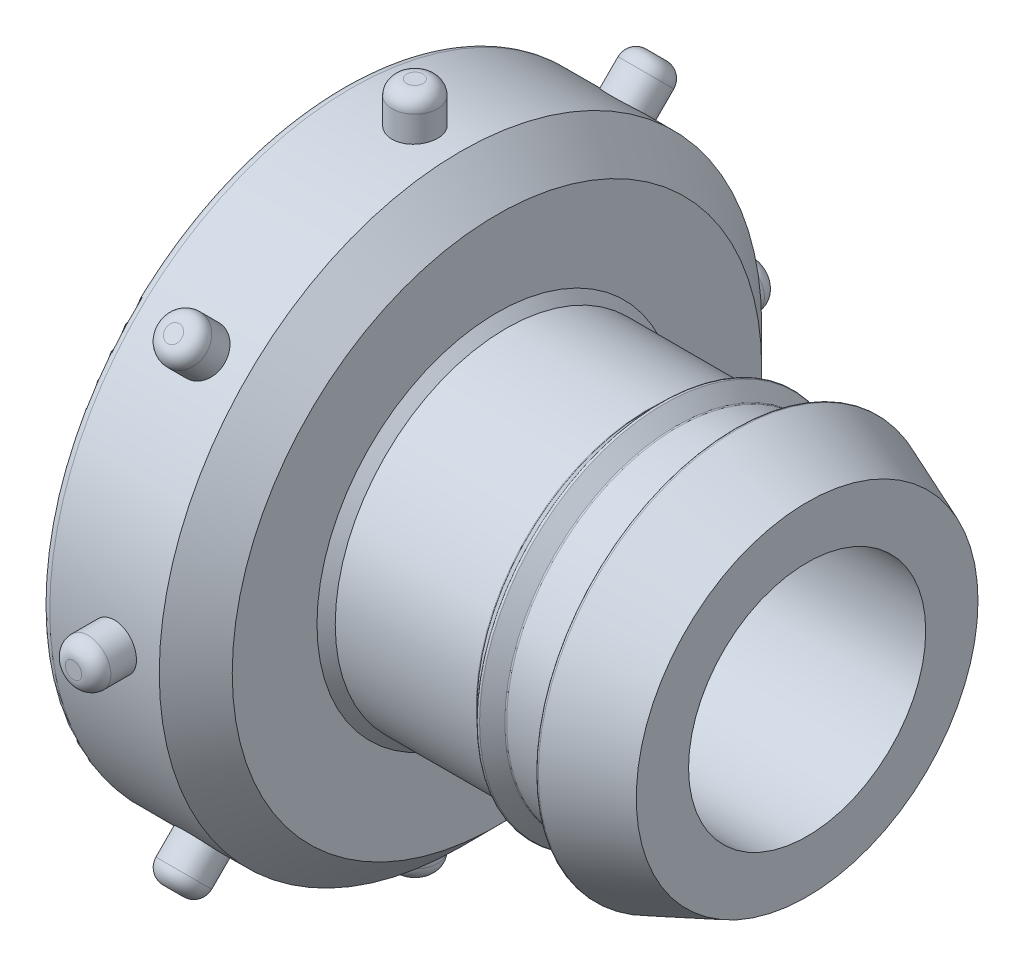
from build123d import *

# Parameters (mm, degrees)
SKETCH2_R                = 16.51
SKETCH2_R_2              = 9.365
SKETCH2_R_3              = 6.5
BOSS_EXTRUDE1_DEPTH      = 8.5
SKETCH4_W                = 18.18
SKETCH4_H                = 13.55
CUT_EXTRUDE1_DEPTH       = 7
SKETCH6_R                = 0.9
FILLET1_R                = 1
BOSS_EXTRUDE2_START      = -2
SKETCH7_R                = 1.25
BOSS_EXTRUDE2_DEPTH      = 4.2
FILLET2_R                = 0.8
CIRPATTERN1_COUNT        = 8
FILLET2_OF_CIRPATTERN1_R = 0.8
CHAMFER1_SIZE            = 2
FILLET3_R                = 0.5
FILLET4_R                = 0.1
CHAMFER2_SIZE            = 0.5
CUT_EXTRUDE2_DEPTH       = 32.450408582
CUT_EXTRUDE2_DEPTH_BACK  = 32.450408582
SKETCH2_3_R              = 6.5
CHAMFER3_SIZE            = 1
CHAMFER3_SIZE2           = 4.010780934
SKETCH8_W                = 2.59
SKETCH8_H                = 7.65
BOSS_EXTRUDE3_DEPTH      = 0.64
FILLET5_R                = 0.5


with BuildPart() as part:
    # Sketch1 → Revolve1 (revolve)
    with BuildSketch(Plane(origin=(0, 0, 0), x_dir=(1, 0, 0), z_dir=(0, 1, 0))):
        Polygon((0, 0), (-17, 0), (-17, 9.365), (-8.73, 9.365), (-7.94, 10.155), (-7.15, 9.365), (-3.97, 9.365), (-3.97, 10.955), (0, 9.365), align=None)
    revolve(axis=Axis((0, 0, 0), (-1, 0, 0)))

    # Sketch2 → Boss-Extrude1 (add)
    # profile 1 of 2: a face of its own
    with BuildSketch(Plane.ZY.offset(17)):
        Circle(SKETCH2_R)
        with Locations(Location((0, 0, 0), (0, 0, 180))):
            Circle(SKETCH2_R_2, mode=Mode.SUBTRACT)
    # profile 2 of 2: a face of its own
    with BuildSketch(Plane.ZY.offset(17)):
        with Locations(Location((0, 0, 0), (0, 0, 180))):
            Circle(SKETCH2_R_2)
        Circle(SKETCH2_R_3, mode=Mode.SUBTRACT)
    extrude(amount=BOSS_EXTRUDE1_DEPTH)

    # Sketch4 → Cut-Extrude1 (cut)
    with BuildSketch(Plane.ZY.offset(25.5)):
        with Locations((0, -0.145)):
            Rectangle(SKETCH4_W, SKETCH4_H)
    extrude(amount=-CUT_EXTRUDE1_DEPTH, mode=Mode.SUBTRACT)

    # Sketch6 → Cut-Revolve1 (revolve, cut)
    with BuildSketch(Plane.XY, mode=Mode.PRIVATE) as cut_revolve1_sk:
        with Locations((-25.5, 14.14)):
            Circle(SKETCH6_R)
    revolve(cut_revolve1_sk.sketch.rotate(Axis((-35.027065124, 0, 0), (1, 0, 0)), 90), axis=Axis((-35.027065124, 0, 0), (1, 0, 0)), mode=Mode.SUBTRACT)

    # Fillet1
    fillet1_edges = [part.edges().sort_by_distance(p)[0] for p in [
        (-25.5, 0, -13.24),
    ]]
    fillet(fillet1_edges, radius=FILLET1_R)

    # Sketch7 → Boss-Extrude2 (add)
    with BuildSketch(Plane(origin=(0, 16.51, 0), x_dir=(1, 0, 0), z_dir=(0, 1, 0)).offset(BOSS_EXTRUDE2_START)):
        with Locations(Location((-21.5, 0, 0), (0, 0, 270))):
            Circle(SKETCH7_R)
    boss_extrude2 = extrude(amount=BOSS_EXTRUDE2_DEPTH)

    # Fillet2
    fillet2_edges = [part.edges().sort_by_distance(p)[0] for p in [
        (-21.5, 18.71, -1.25),
    ]]
    fillet(fillet2_edges, radius=FILLET2_R)

    # CirPattern1: Boss-Extrude2 ×8 about axis
    cirpattern1_axis = Axis((0, 0, 0), (1, 0, 0))
    for i in range(1, CIRPATTERN1_COUNT):
        add(boss_extrude2.rotate(cirpattern1_axis, i * 360 / CIRPATTERN1_COUNT))

    # Fillet2 of CirPattern1
    fillet2_of_cirpattern1_edges = [part.edges().sort_by_distance(p)[0] for p in [
        (-21.5, 14.113851352, 12.3460844),
        (-21.5, 1.25, 18.71),
        (-21.5, -12.3460844, 14.113851352),
        (-21.5, -18.71, 1.25),
        (-21.5, -14.113851352, -12.3460844),
        (-21.5, -1.25, -18.71),
        (-21.5, 12.3460844, -14.113851352),
    ]]
    fillet(fillet2_of_cirpattern1_edges, radius=FILLET2_OF_CIRPATTERN1_R)

    # Chamfer1
    chamfer1_edges = [part.edges().sort_by_distance(p)[0] for p in [
        (-17, 0, -16.51),
    ]]
    chamfer(chamfer1_edges, length=CHAMFER1_SIZE)

    # Fillet3
    fillet3_edges = [part.edges().sort_by_distance(p)[0] for p in [
        (-25.5, 0, -16.51),
    ]]
    fillet(fillet3_edges, radius=FILLET3_R)

    # Fillet4
    fillet4_edges = [part.edges().sort_by_distance(p)[0] for p in [
        (-3.97, 0, 9.365),
        (-3.97, 0, 10.955),
        (-8.73, 0, 9.365),
        (-7.94, 0, 10.155),
        (-7.15, 0, 9.365),
    ]]
    fillet(fillet4_edges, radius=FILLET4_R)

    # Chamfer2
    chamfer2_edges = [part.edges().sort_by_distance(p)[0] for p in [
        (-17, 0, 9.365),
    ]]
    chamfer(chamfer2_edges, length=CHAMFER2_SIZE)

    # Sketch2<3> → Cut-Extrude2 (cut, two sides: drawn at the far end of the back side and taken through both)
    with BuildSketch(Plane.ZY.offset(17).offset(-CUT_EXTRUDE2_DEPTH_BACK)):
        with Locations(Location((0, 0, 0), (0, 0, 180))):
            Circle(SKETCH2_3_R)
    extrude(amount=CUT_EXTRUDE2_DEPTH + CUT_EXTRUDE2_DEPTH_BACK, mode=Mode.SUBTRACT)

    # Chamfer3
    chamfer3_edges = [part.edges().sort_by_distance(p)[0] for p in [
        (-25.5, -6.92, 0),
    ]]
    chamfer3_side = [part.faces().sort_by_distance(p)[0] for p in [
        (-25.5, 0, -12.170205593),
    ]]
    chamfer(chamfer3_edges, length=CHAMFER3_SIZE, length2=CHAMFER3_SIZE2, reference=chamfer3_side[0])

    # Sketch8 → Boss-Extrude3 (add)
    with BuildSketch(Plane.ZY.offset(18.5)):
        with Locations((-7.795, -3.095)):
            Rectangle(SKETCH8_W, SKETCH8_H)
    extrude(amount=BOSS_EXTRUDE3_DEPTH)

    # Fillet5
    fillet5_edges = [part.edges().sort_by_distance(p)[0] for p in [
        (-19.14, -3.095, -6.5),
        (-19.14, 0.73, -7.795),
    ]]
    fillet(fillet5_edges, radius=FILLET5_R)


solid = part.part
